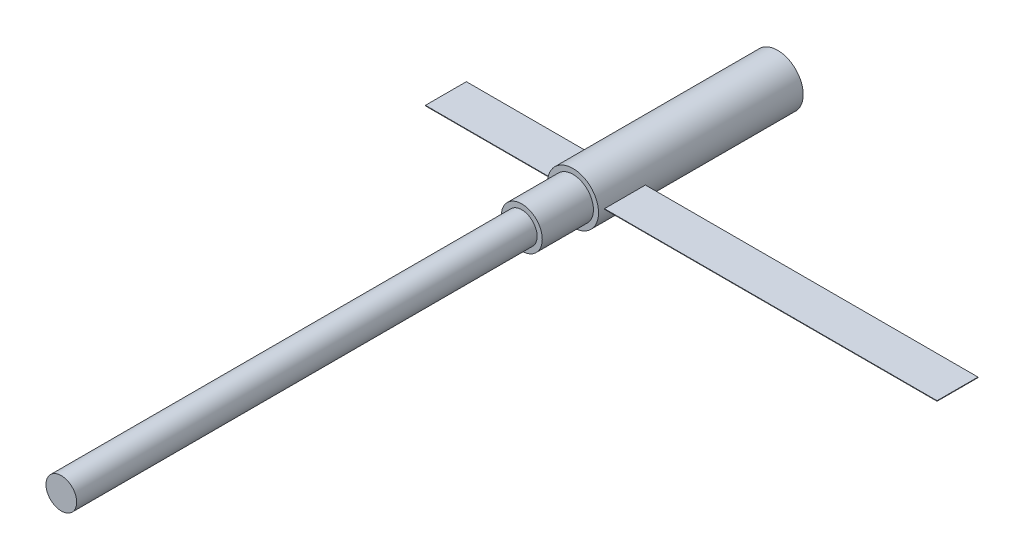
from build123d import *

# Parameters (mm, degrees)
SKETCH_1_R      = 500
EXTRUDE_1_DEPTH = 4000
SKETCH_2_R      = 300
EXTRUDE_2_DEPTH = 10000
SKETCH_6_W      = 10000
SKETCH_6_H      = 800
EXTRUDE_6_DEPTH = 10
SKETCH_7_R      = 400
EXTRUDE_7_DEPTH = 1000


with BuildPart() as part:
    # 草图1 → 凸台-拉伸1 (new body)
    with BuildSketch(Plane.XY):
        Circle(SKETCH_1_R)
    extrude(amount=EXTRUDE_1_DEPTH)

    # 草图2 → 凸台-拉伸2 (add)
    with BuildSketch(Plane.XY.offset(4000)):
        Circle(SKETCH_2_R)
    extrude(amount=EXTRUDE_2_DEPTH)

    # 草图7 → 凸台-拉伸7 (add)
    with BuildSketch(Plane.XY.offset(4000)):
        Circle(SKETCH_7_R)
    extrude(amount=EXTRUDE_7_DEPTH)


with BuildPart() as body_2:
    # 草图6 → 凸台-拉伸6 (new body)
    with BuildSketch(Plane(origin=(0, 0, 0), x_dir=(1, 0, 0), z_dir=(0, 1, 0))):
        with Locations((2000, -900)):
            Rectangle(SKETCH_6_W, SKETCH_6_H)
    extrude(amount=EXTRUDE_6_DEPTH)


with BuildPart() as body_2_1:
    # Move Body 1: moved
    add(body_2.part.moved(Location((0, 0, 1049.359545166))))


with BuildPart() as body_2_2:
    # Move Body 2: moved
    add(body_2_1.part.moved(Location((0, 0, 2037.417385346))))


with BuildPart() as body_2_3:
    # Move Body 3: moved
    add(body_2_2.part.moved(Location((0, 0, -503.298752827))))


solid = Compound([part.part, body_2_3.part])
